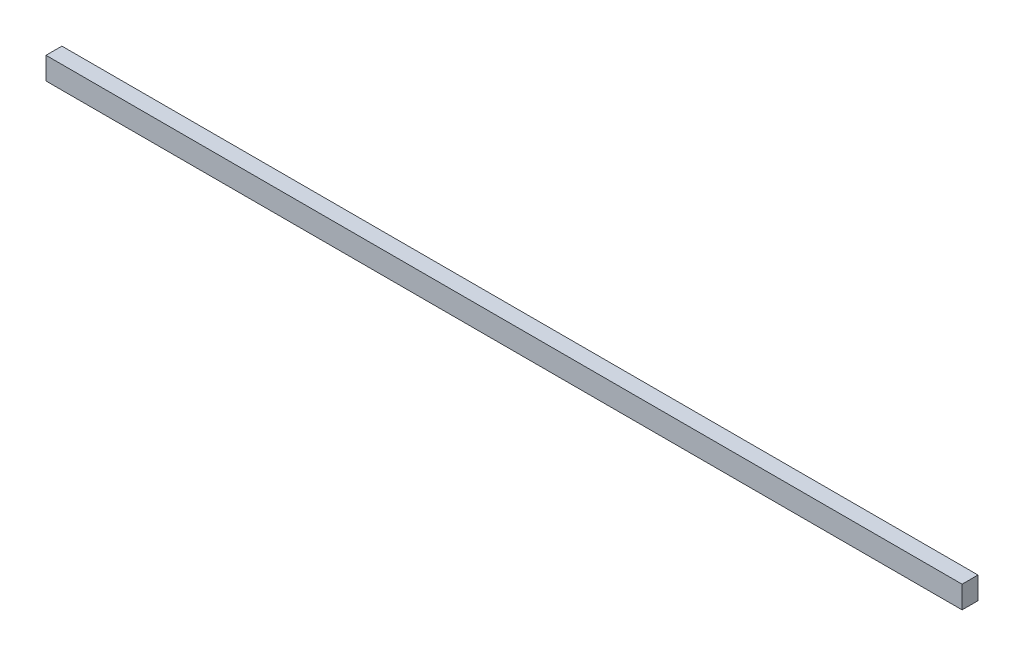
from build123d import *

# Parameters (mm, degrees)
SKETCH1_W           = 287.85234772
SKETCH1_H           = 7
BOSS_EXTRUDE1_DEPTH = 5


with BuildPart() as part:
    # Sketch1 → Boss-Extrude1 (new body)
    with BuildSketch(Plane.XY):
        with Locations((-162.058637525, 0)):
            Rectangle(SKETCH1_W, SKETCH1_H)
    extrude(amount=BOSS_EXTRUDE1_DEPTH)


solid = part.part
